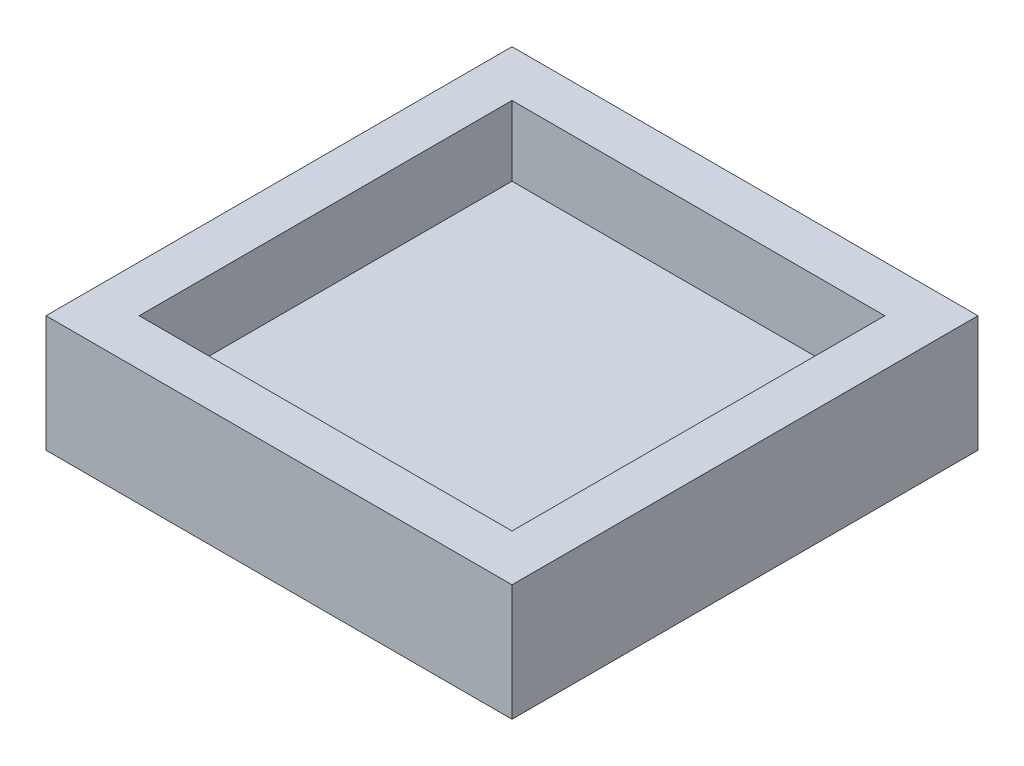
from build123d import *

# Parameters (mm, degrees)
SKETCH2_W           = 25.4
SKETCH2_H           = 25.4
BOSS_EXTRUDE1_DEPTH = 6.35
SHELL2_T            = -2.54


with BuildPart() as part:
    # Sketch2 → Boss-Extrude1 (new body)
    with BuildSketch(Plane(origin=(0, 0, 0), x_dir=(1, 0, 0), z_dir=(0, 1, 0))):
        with Locations((12.7, 12.7)):
            Rectangle(SKETCH2_W, SKETCH2_H)
    extrude(amount=BOSS_EXTRUDE1_DEPTH)

    # Shell2
    shell2_openings = [part.faces().sort_by_distance(p)[0] for p in [
        (12.7, 6.35, -12.7),
    ]]
    offset(amount=SHELL2_T, openings=shell2_openings, kind=Kind.INTERSECTION)


solid = part.part
